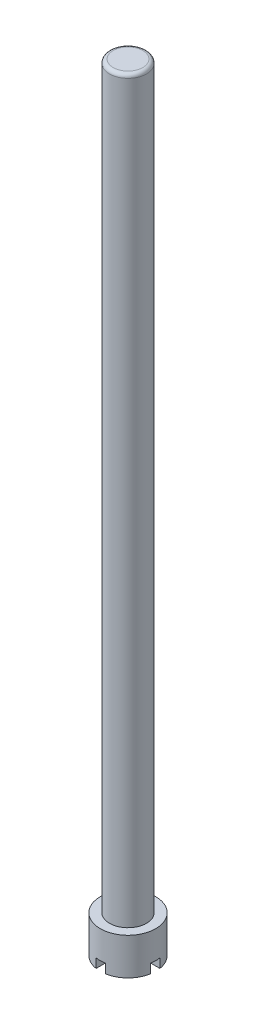
from build123d import *

# Parameters (mm, degrees)
SKETCH1_R           = 0.5
BOSS_EXTRUDE1_DEPTH = 20
SKETCH2_R           = 0.75
BOSS_EXTRUDE2_DEPTH = 1
CUT_EXTRUDE1_DEPTH  = 0.25
FILLET1_R           = 0.1


with BuildPart() as part:
    # Sketch1 → Boss-Extrude1 (new body)
    with BuildSketch(Plane(origin=(0, 0, 0), x_dir=(1, 0, 0), z_dir=(0, 1, 0))):
        with Locations(Location((0, 0, 0), (0, 0, 270))):
            Circle(SKETCH1_R)
    extrude(amount=BOSS_EXTRUDE1_DEPTH)

    # Sketch2 → Boss-Extrude2 (add)
    with BuildSketch(Plane.XZ):
        with Locations(Location((0, 0, 0), (0, 0, 270))):
            Circle(SKETCH2_R)
    extrude(amount=BOSS_EXTRUDE2_DEPTH)

    # Sketch3 → Cut-Extrude1 (cut)
    with BuildSketch(Plane.XZ.offset(1)):
        Polygon((-0.125, 0.125), (-0.875467833, 0.125), (-0.875467833, -0.125), (-0.125, -0.125), (-0.125, -0.835149175), (0.125, -0.835149175), (0.125, -0.125), (0.875467833, -0.125), (0.875467833, 0.125), (0.125, 0.125), (0.125, 0.835149175), (-0.125, 0.835149175), align=None)
    extrude(amount=-CUT_EXTRUDE1_DEPTH, mode=Mode.SUBTRACT)

    # Sketch5 → Cut-Revolve1 (revolve, cut)
    with BuildSketch(Plane(origin=(0, 0, 0), x_dir=(0, 0, -1), z_dir=(1, 0, 0)), mode=Mode.PRIVATE) as cut_revolve1_sk:
        Polygon((0, -0.659007441), (0, -1), (0.25, -1), (0.25, -0.75), align=None)
    revolve(cut_revolve1_sk.sketch.rotate(Axis((0, -0.659007441, 0), (0, 1, 0)), 170.405931773), axis=Axis((0, -0.659007441, 0), (0, 1, 0)), mode=Mode.SUBTRACT)

    # Fillet1
    fillet1_edges = [part.edges().sort_by_distance(p)[0] for p in [
        (0, 20, -0.5),
    ]]
    fillet(fillet1_edges, radius=FILLET1_R)


solid = part.part
